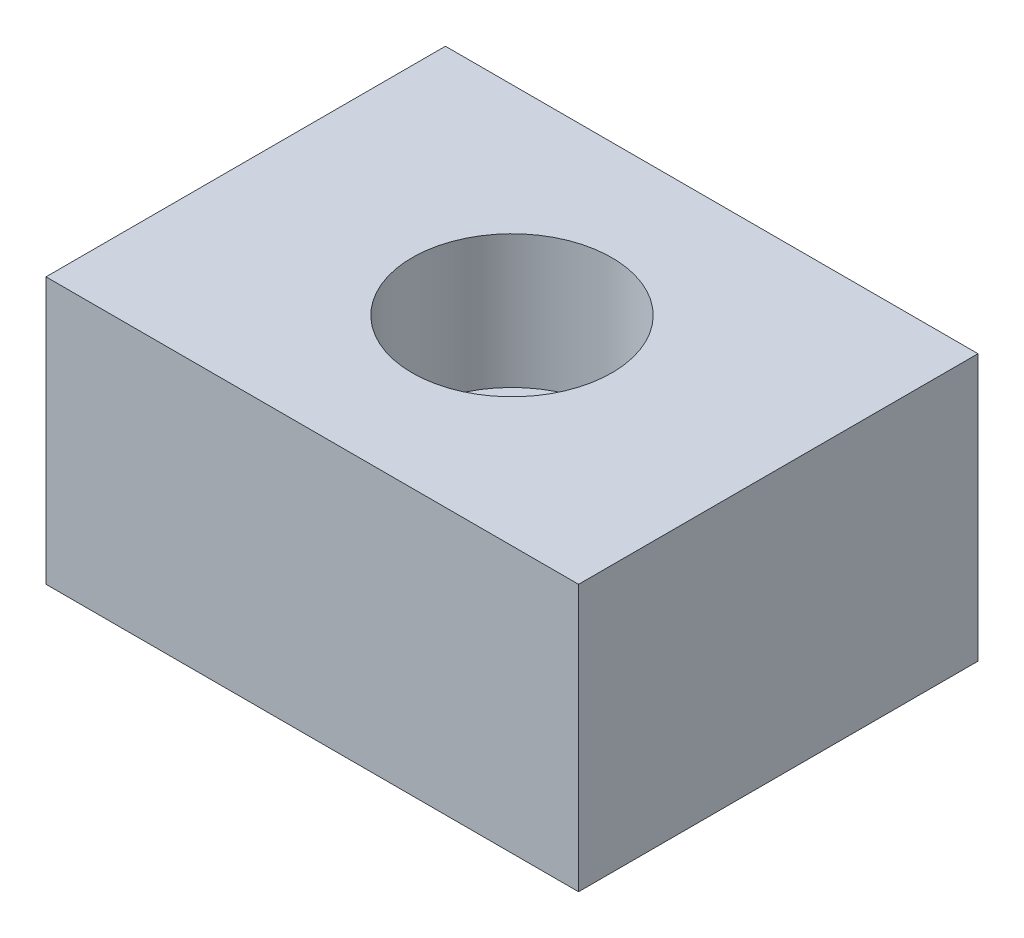
from build123d import *

# Parameters (mm, degrees)
SKETCH1_W           = 25.4
SKETCH1_H           = 19.05
BOSS_EXTRUDE1_DEPTH = 12.7
SKETCH2_R           = 4.7625
CUT_EXTRUDE1_DEPTH  = 6.35
SKETCH3_R           = 3.81
CUT_EXTRUDE2_DEPTH  = 18.097898263


with BuildPart() as part:
    # Sketch1 → Boss-Extrude1 (new body)
    with BuildSketch(Plane(origin=(0, 0, 0), x_dir=(1, 0, 0), z_dir=(0, 1, 0))):
        Rectangle(SKETCH1_W, SKETCH1_H)
    extrude(amount=BOSS_EXTRUDE1_DEPTH)

    # Sketch2 → Cut-Extrude1 (cut)
    with BuildSketch(Plane(origin=(0, 12.7, 0), x_dir=(1, 0, 0), z_dir=(0, 1, 0))):
        with Locations(Location((0, 0, 0), (0, 0, 270))):
            Circle(SKETCH2_R)
    extrude(amount=-CUT_EXTRUDE1_DEPTH, mode=Mode.SUBTRACT)

    # Sketch3 → Cut-Extrude2 (cut, through all)
    with BuildSketch(Plane(origin=(0, 6.35, 0), x_dir=(1, 0, 0), z_dir=(0, 1, 0))):
        with Locations(Location((0, 0, 0), (0, 0, 270))):
            Circle(SKETCH3_R)
    extrude(amount=-CUT_EXTRUDE2_DEPTH, mode=Mode.SUBTRACT)


solid = part.part
